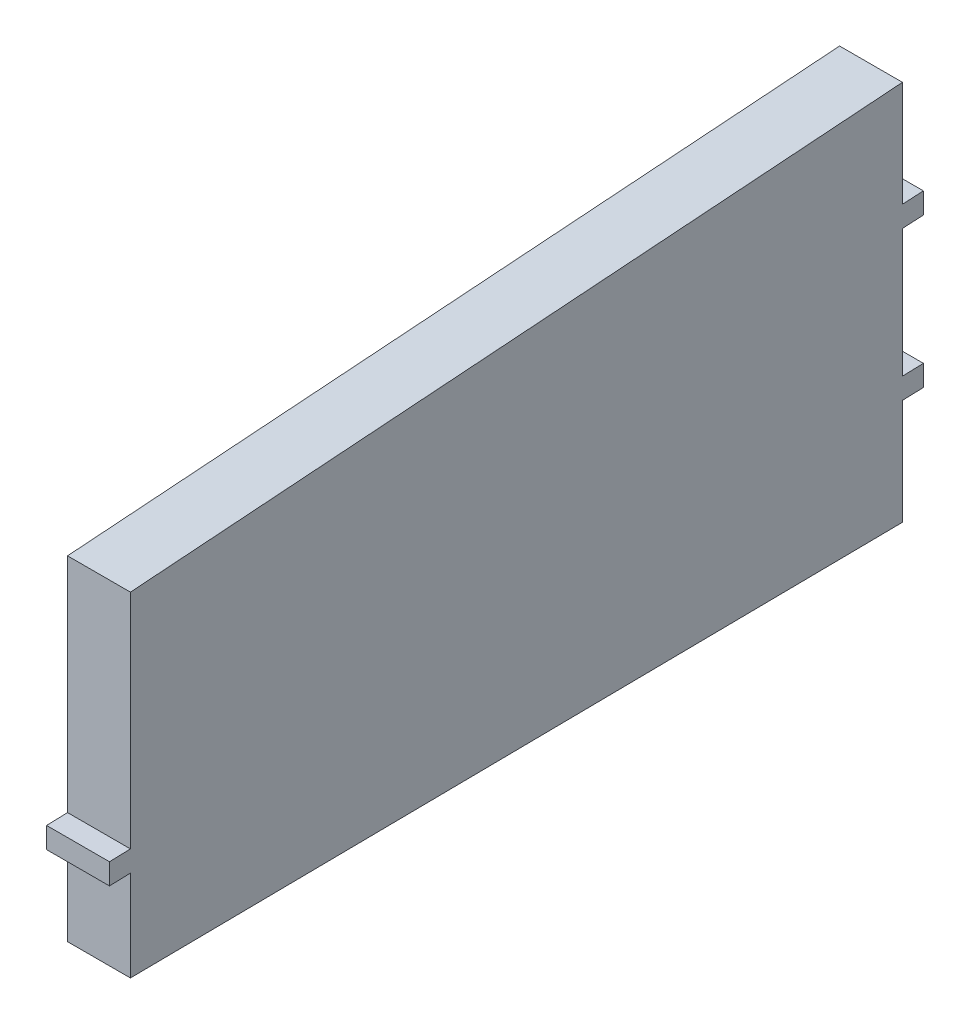
from build123d import *

# Parameters (mm, degrees)
BOSS_EXTRUDE1_DEPTH = 9.525


with BuildPart() as part:
    # Sketch1 → Boss-Extrude1 (new body)
    with BuildSketch(Plane(origin=(243.017706631, 0, 0), x_dir=(0, 0, -1), z_dir=(1, 0, 0))):
        Polygon((-780.056194078, 400.411684614), (-776.881194078, 400.579274957), (-776.881194078, 403.754274957), (-780.056194078, 403.586684614), (-780.056194078, 419.582233203), (-897.002027496, 411.174488345), (-897.002027496, 397.413773631), (-897.002027496, 394.238773631), (-897.002027496, 377.48974838), (-900.177027496, 377.393537661), (-900.177027496, 374.218537661), (-897.002027496, 374.31474838), (-897.002027496, 360.554033667), (-780.056194078, 361.862961273), (-780.056194078, 377.858509862), (-776.881194078, 377.954720581), (-776.881194078, 381.129720581), (-780.056194078, 381.033509862), align=None)
    extrude(amount=BOSS_EXTRUDE1_DEPTH)


solid = part.part
